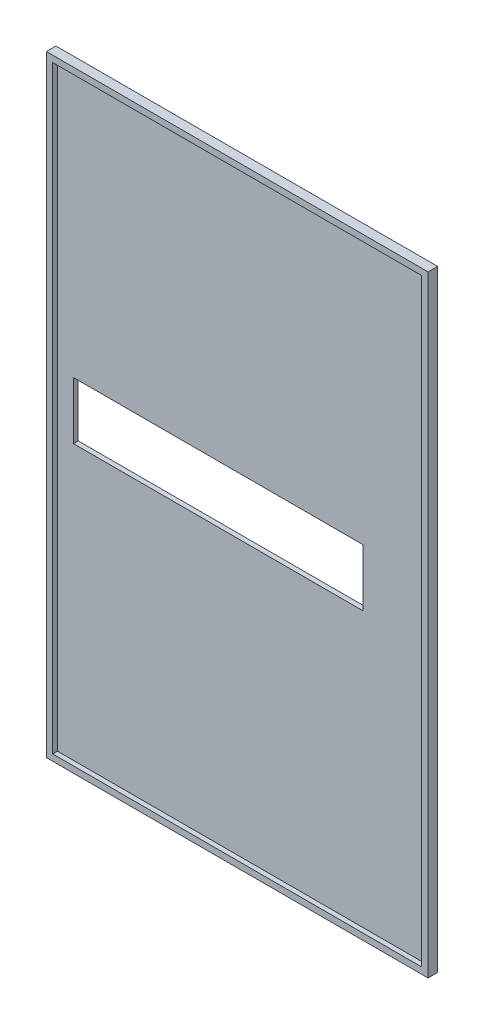
from build123d import *

# Parameters (mm, degrees)
SKETCH1_W           = 120
SKETCH1_H           = 192.24
BOSS_EXTRUDE1_DEPTH = 3
SKETCH2_W           = 116
SKETCH2_H           = 188.24
CUT_EXTRUDE2_DEPTH  = 1.5
SKETCH3_W           = 91
SKETCH3_H           = 18
CUT_EXTRUDE3_DEPTH  = 1.5


with BuildPart() as part:
    # Sketch1 → Boss-Extrude1 (new body)
    with BuildSketch(Plane.XY):
        with Locations((60, -96.12)):
            Rectangle(SKETCH1_W, SKETCH1_H)
    extrude(amount=BOSS_EXTRUDE1_DEPTH)

    # Sketch2 → Cut-Extrude2 (cut)
    with BuildSketch(Plane.XY.offset(3)):
        with Locations((60, -96.12)):
            Rectangle(SKETCH2_W, SKETCH2_H)
    extrude(amount=-CUT_EXTRUDE2_DEPTH, mode=Mode.SUBTRACT)

    # Sketch3 → Cut-Extrude3 (cut)
    with BuildSketch(Plane(origin=(0, 0, 0), x_dir=(-1, 0, 0), z_dir=(0, 0, -1))):
        with Locations((-52.5, -95)):
            Rectangle(SKETCH3_W, SKETCH3_H)
    extrude(amount=-CUT_EXTRUDE3_DEPTH, mode=Mode.SUBTRACT)


solid = part.part
